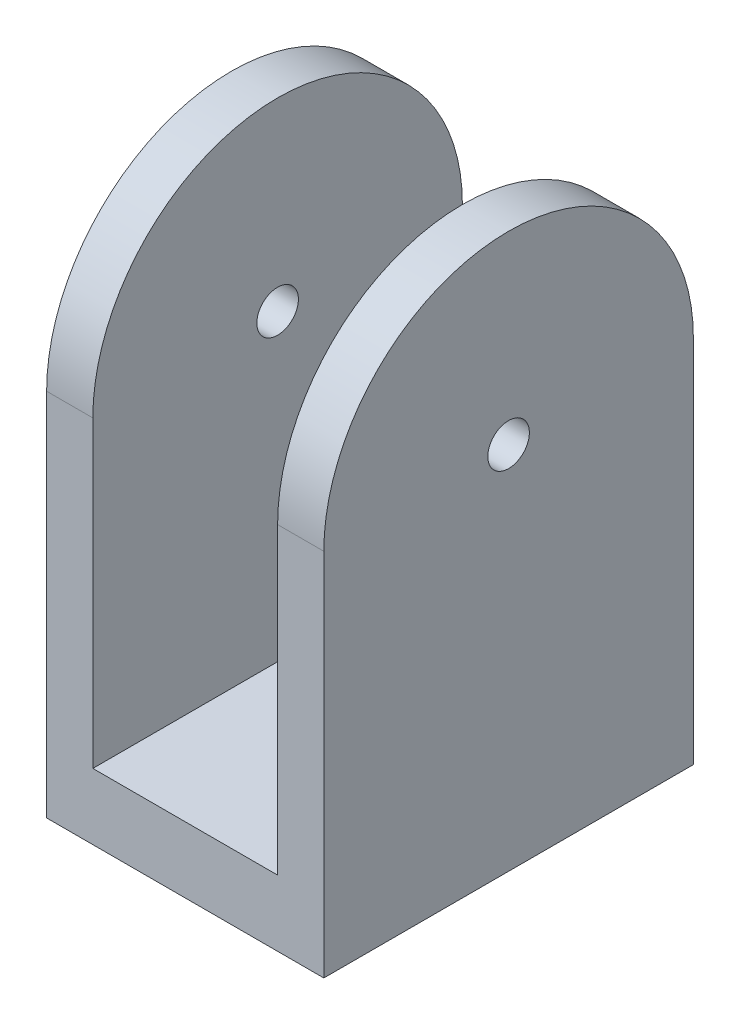
from build123d import *

# Parameters (mm, degrees)
BOSS_EXTRUDE1_DEPTH = 30
SKETCH2_W           = 20
SKETCH2_H           = 200
CUT_EXTRUDE1_DEPTH  = 260
SKETCH3_R           = 2.25
CUT_EXTRUDE2_DEPTH  = 71
SKETCH5_R           = 2.25
CUT_EXTRUDE3_DEPTH  = 71


with BuildPart() as part:
    # Sketch1 → Boss-Extrude1 (new body)
    with BuildSketch(Plane(origin=(0, 0, 0), x_dir=(0, 0, -1), z_dir=(1, 0, 0))):
        with BuildLine():
            Line((20, 0), (-20, 0))
            Line((-20, 0), (-20, 40))
            ThreePointArc((-20, 40), (0, 60), (20, 40))
            Line((20, 40), (20, 0))
        make_face()
    extrude(amount=BOSS_EXTRUDE1_DEPTH)

    # Sketch2 → Cut-Extrude1 (cut)
    with BuildSketch(Plane(origin=(0, 267.144833217, 0), x_dir=(1, 0, 0), z_dir=(0, 1, 0))):
        with Locations((15, 0)):
            Rectangle(SKETCH2_W, SKETCH2_H)
    extrude(amount=-CUT_EXTRUDE1_DEPTH, mode=Mode.SUBTRACT)

    # Sketch3 → Cut-Extrude2 (cut, through all)
    with BuildSketch(Plane.XZ):
        with Locations(Location((15, 0, 0), (0, 0, 270))):
            Circle(SKETCH3_R)
    extrude(amount=-CUT_EXTRUDE2_DEPTH, mode=Mode.SUBTRACT)

    # Sketch5 → Cut-Extrude3 (cut, through all)
    with BuildSketch(Plane(origin=(30, 0, 0), x_dir=(0, 0, -1), z_dir=(1, 0, 0))):
        with Locations((0, 40)):
            Circle(SKETCH5_R)
    extrude(amount=-CUT_EXTRUDE3_DEPTH, mode=Mode.SUBTRACT)


solid = part.part
